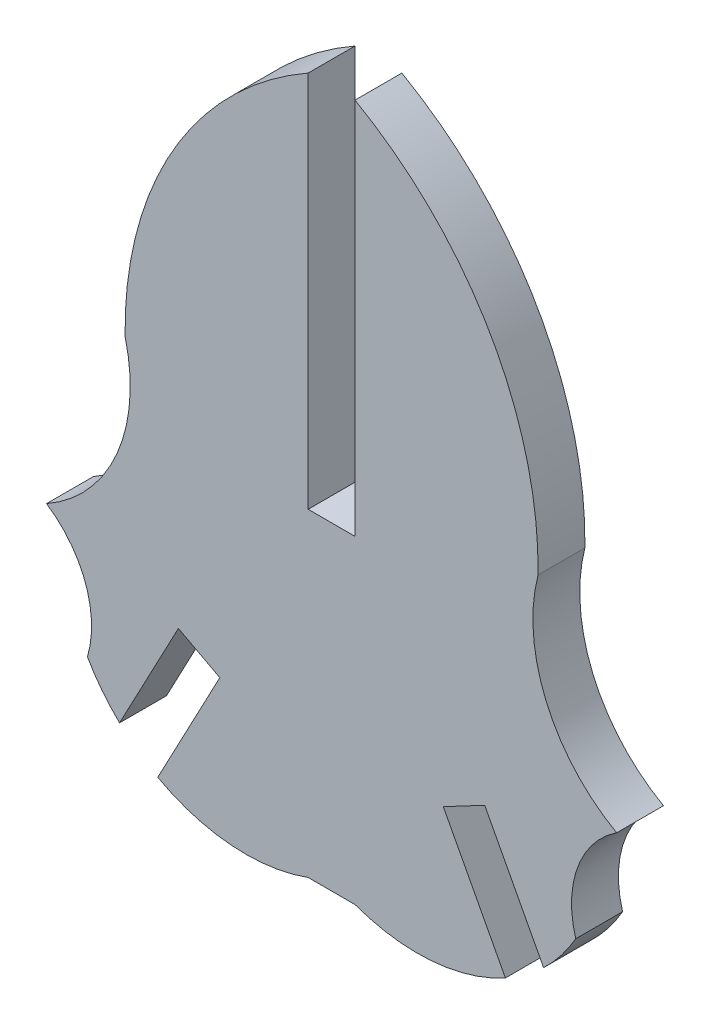
from build123d import *

# Parameters (mm, degrees)
BOSS_EXTRUDE1_DEPTH = 1.524


with BuildPart() as part:
    # Sketch1 → Boss-Extrude1 (new body)
    with BuildSketch(Plane.XY):
        with BuildLine():
            Line((0, 114.851197301), (1.524, 114.851197301))
            Line((1.524, 114.851197301), (1.524, 127.137521288))
            ThreePointArc((1.524, 127.137521288), (5.925149422, 122.754651777), (7.476746905, 116.740318344))
            ThreePointArc((7.476746905, 116.740318344), (7.739144324, 113.314611295), (10.032707403, 110.756508563))
            ThreePointArc((10.032707403, 110.756508563), (8.763036176, 109.151405897), (8.701919017, 107.105755809))
            ThreePointArc((8.701919017, 107.105755809), (8.227293035, 106.400067512), (7.656654449, 105.769482545))
            Line((7.656654449, 105.769482545), (5.742583542, 109.386323923))
            Line((5.742583542, 109.386323923), (4.395578742, 108.673474663))
            Line((4.395578742, 108.673474663), (6.414912826, 104.857727272))
            ThreePointArc((6.414912826, 104.857727272), (4.010280896, 104.139935188), (1.524, 104.480357725))
            Line((1.524, 104.480357725), (0, 104.480357725))
            ThreePointArc((0, 104.480357725), (-2.486280896, 104.139935188), (-4.890912826, 104.857727272))
            Line((-4.890912826, 104.857727272), (-2.871578742, 108.673474663))
            Line((-2.871578742, 108.673474663), (-4.218583542, 109.386323923))
            Line((-4.218583542, 109.386323923), (-6.132654449, 105.769482545))
            ThreePointArc((-6.132654449, 105.769482545), (-6.703293035, 106.400067512), (-7.177919017, 107.105755809))
            ThreePointArc((-7.177919017, 107.105755809), (-7.239036176, 109.151405897), (-8.508707403, 110.756508563))
            ThreePointArc((-8.508707403, 110.756508563), (-6.215144324, 113.314611295), (-5.952746905, 116.740318344))
            ThreePointArc((-5.952746905, 116.740318344), (-4.401149422, 122.754651777), (0, 127.137521288))
            Line((0, 127.137521288), (0, 114.851197301))
        make_face()
    extrude(amount=BOSS_EXTRUDE1_DEPTH)


solid = part.part
